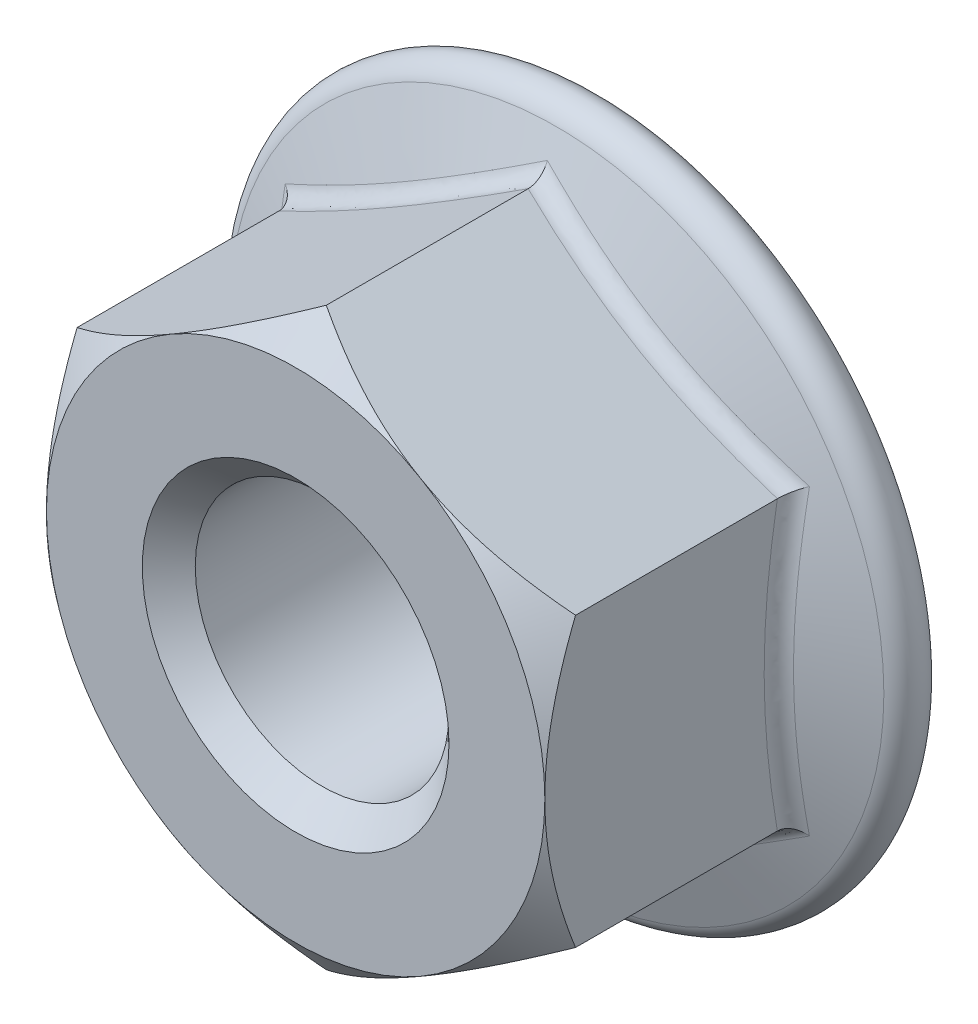
from build123d import *

# Parameters (mm, degrees)
SCHIZZO1_R                   = 3.3095
ESTRUSIONE_ESTRUSIONE1_DEPTH = 8
RACCORDO1_R                  = 0.48
SMUSSO1_SIZE                 = 0.6905


with BuildPart() as part:
    # Schizzo1 → Estrusione-Estrusione1 (new body)
    with BuildSketch(Plane.XY):
        Polygon((0, 7.505553499), (-6.5, 3.75277675), (-6.5, -3.75277675), (0, -7.505553499), (6.5, -3.75277675), (6.5, 3.75277675), align=None)
        Circle(SCHIZZO1_R, mode=Mode.SUBTRACT)
    extrude(amount=ESTRUSIONE_ESTRUSIONE1_DEPTH)

    # Schizzo2 → Rivoluzione1 (revolve)
    with BuildSketch(Plane(origin=(0, 0, 0), x_dir=(0, 0, -1), z_dir=(1, 0, 0)), mode=Mode.PRIVATE) as rivoluzione1_sk:
        with BuildLine():
            Line((0, 3.3095), (0, 8.331345278))
            ThreePointArc((0, 8.331345278), (-0.511226457, 8.940601245), (-1.2, 8.542937654))
            Line((-1.2, 8.542937654), (-3.104815529, 3.3095))
            Line((-3.104815529, 3.3095), (0, 3.3095))
        make_face()
    revolve(rivoluzione1_sk.sketch.rotate(Axis((0, 0, 0), (0, 0, 1)), 90), axis=Axis((0, 0, 0), (0, 0, 1)))

    # Schizzo3 → Taglia-Rivoluzione1 (revolve, cut)
    with BuildSketch(Plane(origin=(0, 0, 0), x_dir=(0, 0, -1), z_dir=(1, 0, 0)), mode=Mode.PRIVATE) as taglia_rivoluzione1_sk:
        Polygon((-8, 6.5), (-7.2, 7.505553499), (-7.2, 20.205553499), (-20.7, 20.205553499), (-20.7, 6.5), align=None)
    revolve(taglia_rivoluzione1_sk.sketch.rotate(Axis((0, 0, 8), (0, 0, -1)), 270), axis=Axis((0, 0, 8), (0, 0, -1)), mode=Mode.SUBTRACT)

    # Raccordo1
    raccordo1_edges = [part.edges().sort_by_distance(p)[0] for p in [
        (-6.5, -1.884573791, 1.846137562),
        (-3.25, -5.629165125, 1.943568497),
        (3.25, -5.629165125, 1.943568497),
        (6.5, 0, 1.943568497),
        (3.25, 5.629165125, 1.943568497),
        (-3.25, 5.629165125, 1.943568497),
        (-6.5, 1.884573791, 1.846137562),
    ]]
    fillet(raccordo1_edges, radius=RACCORDO1_R)

    # Smusso1
    smusso1_edges = [part.edges().sort_by_distance(p)[0] for p in [
        (-3.3095, 0, 0),
        (-3.3095, 0, 8),
    ]]
    chamfer(smusso1_edges, length=SMUSSO1_SIZE)


solid = part.part
